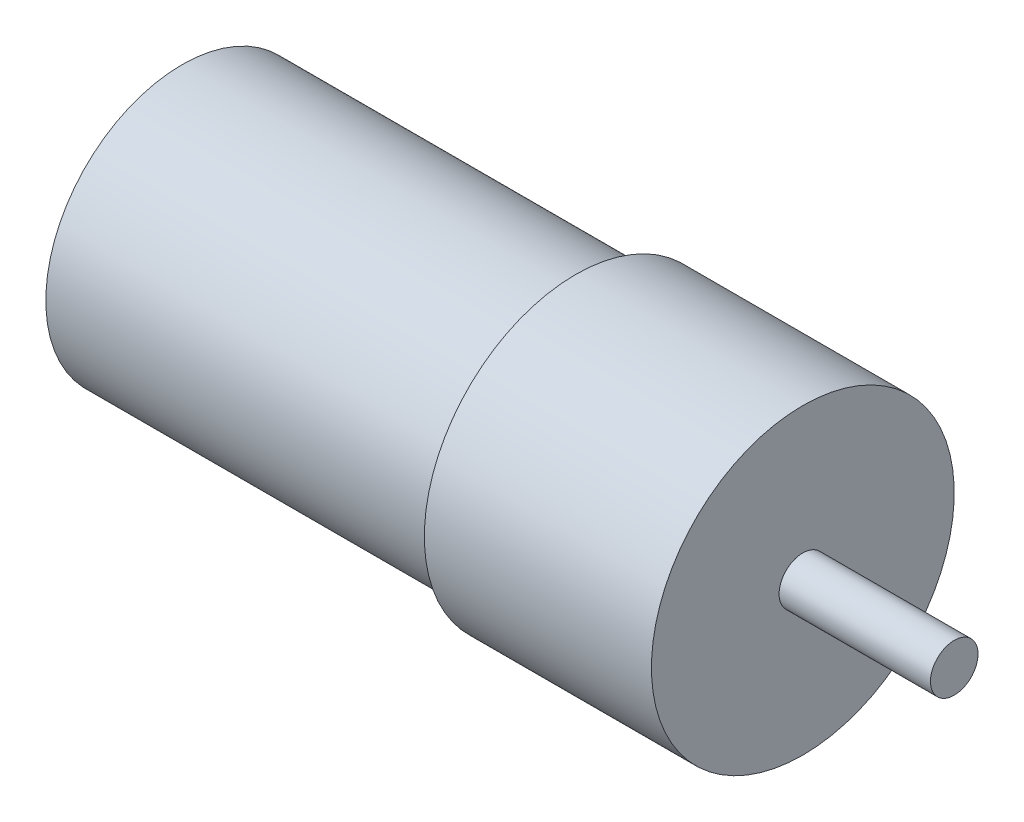
from build123d import *


with BuildPart() as part:
    # Sketch1 → Revolve1 (revolve)
    with BuildSketch(Plane.XY, mode=Mode.PRIVATE) as revolve1_sk:
        Polygon((0, 0), (0, 1.9939), (-12.7, 1.9939), (-12.7, 12.7), (-31.75, 12.7), (-31.75, 11.43), (-64.77, 11.43), (-64.77, 0), align=None)
    revolve(revolve1_sk.sketch.rotate(Axis((-64.77, 0, 0), (1, 0, 0)), 180), axis=Axis((-64.77, 0, 0), (1, 0, 0)))


solid = part.part
